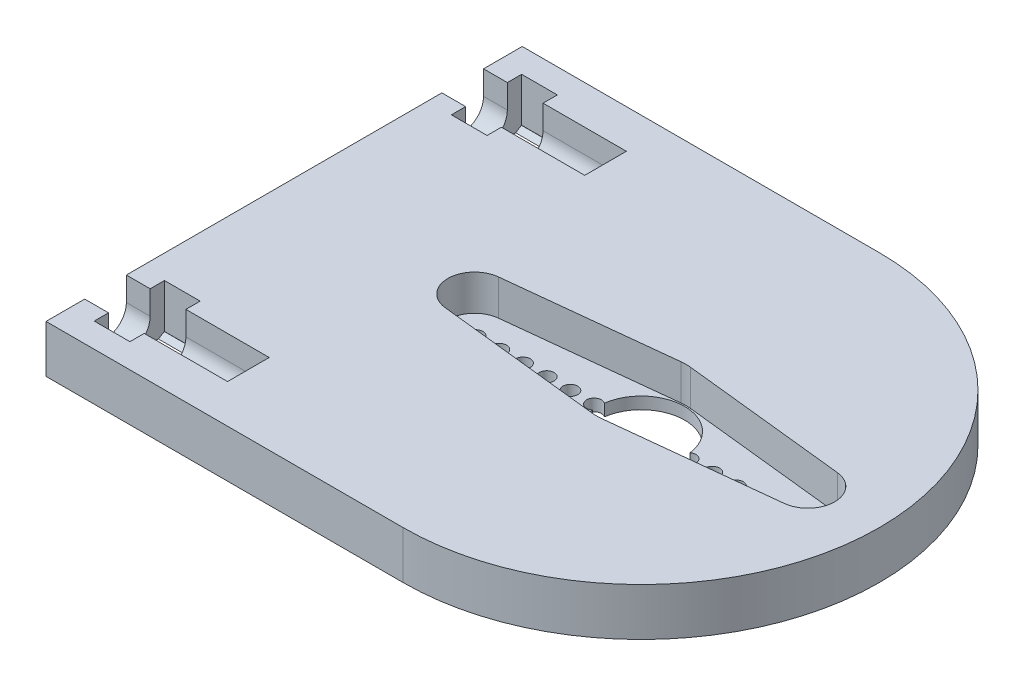
from build123d import *

# Parameters (mm, degrees)
BOSS_EXTRUDE1_DEPTH = 3.999992
CUT_EXTRUDE1_DEPTH  = 1.999996
CUT_EXTRUDE2_REACH  = 56
CUT_EXTRUDE3_DEPTH  = 3.703193
CUT_EXTRUDE4_DEPTH  = 2.999994
SKETCH6_R           = 0.621776252
CUT_EXTRUDE5_DEPTH  = 41.509250857
CUT_EXTRUDE6_DEPTH  = 2.999994


with BuildPart() as part:
    # Sketch1 → Boss-Extrude1 (new body)
    with BuildSketch(Plane(origin=(0, 0, 0), x_dir=(1, 0, 0), z_dir=(0, 1, 0))):
        with BuildLine():
            Line((-14.9999954, -19.9999981), (14.9999954, -19.9999981))
            ThreePointArc((14.9999954, -19.9999981), (34.9999935, 0), (14.9999954, 19.9999981))
            Line((14.9999954, 19.9999981), (-14.9999954, 19.9999981))
            Line((-14.9999954, 19.9999981), (-14.9999954, -19.9999981))
        make_face()
    extrude(amount=BOSS_EXTRUDE1_DEPTH)

    # Sketch2 → Cut-Extrude1 (cut)
    with BuildSketch(Plane(origin=(0, 3.999992, 0), x_dir=(1, 0, 0), z_dir=(0, 1, 0))):
        Polygon((-14.9999954, -16.7499919), (-14.9999954, -13.2499989), (-12.9999994, -13.2499989), (-12.9999994, -12.0500013), (-10.0000054, -12.0500013), (-10.0000054, -13.2499989), (-2.999994, -13.2499989), (-2.999994, -16.7499919), (-10.0000054, -16.7499919), (-10.0000054, -17.9499895), (-12.9999994, -17.9499895), (-12.9999994, -16.7499919), align=None)
        Polygon((-14.9999954, 16.7499919), (-12.9999994, 16.7499919), (-12.9999994, 17.9499895), (-10.0000054, 17.9499895), (-10.0000054, 16.7499919), (-2.999994, 16.7499919), (-2.999994, 13.2499989), (-10.0000054, 13.2499989), (-10.0000054, 12.0500013), (-12.9999994, 12.0500013), (-12.9999994, 13.2499989), (-14.9999954, 13.2499989), align=None)
    extrude(amount=-CUT_EXTRUDE1_DEPTH, mode=Mode.SUBTRACT)

    # Cut-Extrude2: up to this face of the body (flat: up to its plane)
    cut_extrude2_end = Plane(part.part.faces().sort_by_distance((-2.999994, 2.999994, -14.9999954))[0])
    # Sketch3 → Cut-Extrude2 (cut, up to the picked face)
    with BuildSketch(Plane.ZY.offset(14.9999954), mode=Mode.PRIVATE) as cut_extrude2_sk1:
        with BuildLine():
            Line((13.2499989, 1.999996), (16.7499919, 1.999996))
            ThreePointArc((16.7499919, 1.999996), (14.9999954, 0.2499995), (13.2499989, 1.999996))
        make_face()
    cut_extrude2_tool1 = split(extrude(cut_extrude2_sk1.sketch, amount=-CUT_EXTRUDE2_REACH, mode=Mode.PRIVATE), bisect_by=cut_extrude2_end, keep=Keep.BOTH, mode=Mode.PRIVATE)
    # Sketch3 → Cut-Extrude2 (cut, up to the picked face)
    with BuildSketch(Plane.ZY.offset(14.9999954), mode=Mode.PRIVATE) as cut_extrude2_sk2:
        with BuildLine():
            Line((-13.2499989, 1.999996), (-16.7499919, 1.999996))
            ThreePointArc((-16.7499919, 1.999996), (-14.9999954, 0.2499995), (-13.2499989, 1.999996))
        make_face()
    cut_extrude2_tool2 = split(extrude(cut_extrude2_sk2.sketch, amount=-CUT_EXTRUDE2_REACH, mode=Mode.PRIVATE), bisect_by=cut_extrude2_end, keep=Keep.BOTH, mode=Mode.PRIVATE)
    add(cut_extrude2_tool1.solids().sort_by(Axis((-14.999995, 1.257274, 14.999995), (1, 0, 0)))[0], mode=Mode.SUBTRACT)
    add(cut_extrude2_tool2.solids().sort_by(Axis((-14.999995, 1.257274, -14.999995), (1, 0, 0)))[0], mode=Mode.SUBTRACT)

    # Sketch4 → Cut-Extrude3 (cut)
    with BuildSketch(Plane(origin=(0, 3.999992, 0), x_dir=(1, 0, 0), z_dir=(0, 1, 0))):
        Polygon((-12.9999994, 13.2499989), (-12.9999994, 12.0500013), (-10.0000054, 12.0500013), (-10.0000054, 13.2499989), (-10.0000054, 16.7499919), (-10.0000054, 17.9499895), (-12.9999994, 17.9499895), (-12.9999994, 16.7499919), align=None)
        Polygon((-10.0000054, -16.7499919), (-10.0000054, -13.2499989), (-10.0000054, -12.0500013), (-12.9999994, -12.0500013), (-12.9999994, -13.2499989), (-12.9999994, -16.7499919), (-12.9999994, -17.9499895), (-10.0000054, -17.9499895), align=None)
    extrude(amount=-CUT_EXTRUDE3_DEPTH, mode=Mode.SUBTRACT)

    # Sketch5 → Cut-Extrude4 (cut)
    with BuildSketch(Plane.ZY.offset(10.0000054)):
        Polygon((-17.4419895, 0), (-12.5580013, 0), (-12.0500013, 0.3048), (-17.9499895, 0.3048), align=None)
        Polygon((12.5580013, 0), (12.0500013, 0.3048), (17.9499895, 0.3048), (17.4419895, 0), align=None)
    extrude(amount=CUT_EXTRUDE4_DEPTH, mode=Mode.SUBTRACT)

    # Sketch6 → Cut-Extrude5 (cut, through all)
    with BuildSketch(Plane(origin=(0, 3.999992, 0), x_dir=(1, 0, 0), z_dir=(0, 1, 0))):
        with BuildLine():
            ThreePointArc((18.60506983, 0.504260657), (19.593270199, 0.000879919), (18.60506983, -0.502500819))
            ThreePointArc((18.60506983, -0.502500819), (14.9999954, -3.639168681), (11.39492097, -0.502500819))
            ThreePointArc((11.39492097, -0.502500819), (10.406720601, 0.000879919), (11.39492097, 0.504260657))
            ThreePointArc((11.39492097, 0.504260657), (14.9999954, 3.640928519), (18.60506983, 0.504260657))
        make_face()
        with Locations(Location((9.040415251, 0.000347085, 0), (0, 0, 270))):
            Circle(SKETCH6_R)
        with Locations(Location((7.051800737, 0.000347085, 0), (0, 0, 270))):
            Circle(SKETCH6_R)
        with Locations(Location((5.063186223, 0.000347085, 0), (0, 0, 270))):
            Circle(SKETCH6_R)
        with Locations(Location((3.074571709, 0.000347085, 0), (0, 0, 270))):
            Circle(SKETCH6_R)
        with Locations(Location((1.085957195, 0.000347085, 0), (0, 0, 270))):
            Circle(SKETCH6_R)
        with Locations(Location((20.959575549, 0.000347085, 0), (0, 0, 270))):
            Circle(SKETCH6_R)
        with Locations(Location((22.948190063, 0.000347085, 0), (0, 0, 270))):
            Circle(SKETCH6_R)
        with Locations(Location((24.936804577, 0.000347085, 0), (0, 0, 270))):
            Circle(SKETCH6_R)
        with Locations(Location((26.925419091, 0.000347085, 0), (0, 0, 270))):
            Circle(SKETCH6_R)
        with Locations(Location((28.914033605, 0.000347085, 0), (0, 0, 270))):
            Circle(SKETCH6_R)
    extrude(amount=-CUT_EXTRUDE5_DEPTH, mode=Mode.SUBTRACT)

    # Sketch7 → Cut-Extrude6 (cut)
    with BuildSketch(Plane(origin=(0, 3.999992, 0), x_dir=(1, 0, 0), z_dir=(0, 1, 0))):
        with BuildLine():
            Line((0.7589266, 2.237934119), (14.5982182, 3.734679919))
            ThreePointArc((14.5982182, 3.734679919), (14.9999954, 3.75634324), (15.4017726, 3.734679919))
            Line((15.4017726, 3.734679919), (29.2410642, 2.237934119))
            ThreePointArc((29.2410642, 2.237934119), (31.249997536, 0.000879919), (29.2410642, -2.236174281))
            Line((29.2410642, -2.236174281), (15.4017726, -3.732920081))
            ThreePointArc((15.4017726, -3.732920081), (14.9999954, -3.754583403), (14.5982182, -3.732920081))
            Line((14.5982182, -3.732920081), (0.7589266, -2.236174281))
            ThreePointArc((0.7589266, -2.236174281), (-1.250006736, 0.000879919), (0.7589266, 2.237934119))
        make_face()
    extrude(amount=-CUT_EXTRUDE6_DEPTH, mode=Mode.SUBTRACT)


solid = part.part
